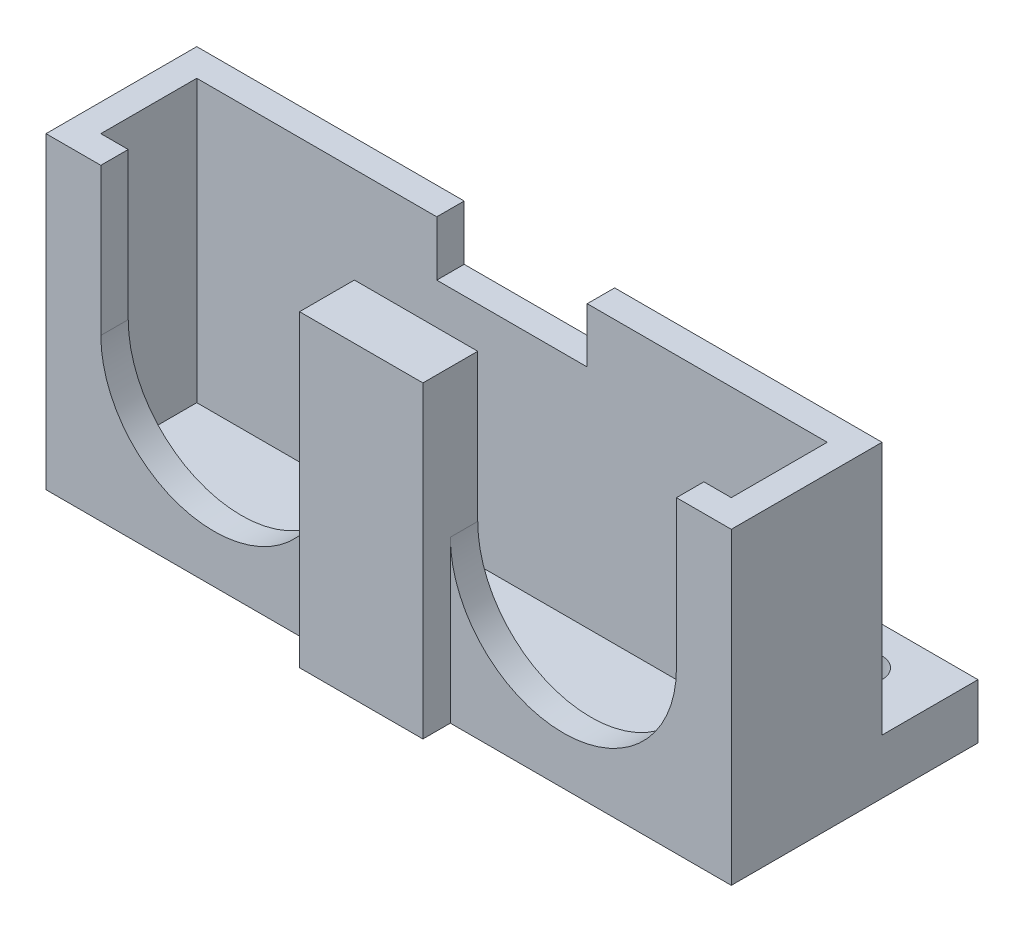
from build123d import *

# Parameters (mm, degrees)
ESBO_O1_W                = 50
ESBO_O1_H                = 11
RESSALTO_EXTRUS_O1_DEPTH = 22.5
ESBO_O2_W                = 46
ESBO_O2_H                = 7
CORTE_EXTRUS_O1_DEPTH    = 20.5
ESBO_O3_W                = 10.97916057
ESBO_O3_H                = 2
CORTE_EXTRUS_O2_DEPTH    = 4
CORTE_EXTRUS_O3_DEPTH    = 4
ESBO_O9_W                = 50
ESBO_O9_H                = 4
RESSALTO_EXTRUS_O4_DEPTH = 7
ESBO_O13_R               = 1.5
CORTE_EXTRUS_O4_DEPTH    = 7
ESBO_O19_W               = 9
ESBO_O19_H               = 4
RESSALTO_EXTRUS_O5_DEPTH = 22.5


with BuildPart() as part:
    # Esboço1 → Ressalto-extrusão1 (new body)
    with BuildSketch(Plane(origin=(0, 0, 0), x_dir=(1, 0, 0), z_dir=(0, 1, 0))):
        Rectangle(ESBO_O1_W, ESBO_O1_H)
    extrude(amount=RESSALTO_EXTRUS_O1_DEPTH)

    # Esboço2 → Corte-extrusão1 (cut)
    with BuildSketch(Plane(origin=(0, 22.5, 0), x_dir=(1, 0, 0), z_dir=(0, 1, 0))):
        Rectangle(ESBO_O2_W, ESBO_O2_H)
    extrude(amount=-CORTE_EXTRUS_O1_DEPTH, mode=Mode.SUBTRACT)

    # Esboço3 → Corte-extrusão2 (cut)
    with BuildSketch(Plane(origin=(0, 22.5, 0), x_dir=(1, 0, 0), z_dir=(0, 1, 0))):
        with Locations((0, 4.5)):
            Rectangle(ESBO_O3_W, ESBO_O3_H)
    extrude(amount=-CORTE_EXTRUS_O2_DEPTH, mode=Mode.SUBTRACT)

    # Esboço5 → Corte-extrusão3 (cut)
    with BuildSketch(Plane.XY.offset(5.5)):
        with BuildLine():
            Line((-21, 22.5), (-4.5, 22.5))
            Line((-4.5, 22.5), (-4.5, 11.75))
            ThreePointArc((-4.5, 11.75), (-12.75, 3.5), (-21, 11.75))
            Line((-21, 11.75), (-21, 22.5))
        make_face()
        with BuildLine():
            Line((4.5, 22.5), (21, 22.5))
            Line((21, 22.5), (21, 11.75))
            ThreePointArc((21, 11.75), (12.75, 3.5), (4.5, 11.75))
            Line((4.5, 11.75), (4.5, 22.5))
        make_face()
    extrude(amount=-CORTE_EXTRUS_O3_DEPTH, mode=Mode.SUBTRACT)

    # Esboço9 → Ressalto-extrusão4 (add)
    with BuildSketch(Plane(origin=(0, 0, -5.5), x_dir=(-1, 0, 0), z_dir=(0, 0, -1))):
        with Locations((0, 2)):
            Rectangle(ESBO_O9_W, ESBO_O9_H)
    extrude(amount=RESSALTO_EXTRUS_O4_DEPTH)

    # Esboço13 → Corte-extrusão4 (cut)
    with BuildSketch(Plane(origin=(0, 4, 0), x_dir=(1, 0, 0), z_dir=(0, 1, 0))):
        with Locations(Location((10, 9, 0), (0, 0, 270))):
            Circle(ESBO_O13_R)
        with Locations(Location((5, 9, 0), (0, 0, 270))):
            Circle(ESBO_O13_R)
        with Locations(Location((20, 9, 0), (0, 0, 270))):
            Circle(ESBO_O13_R)
        with Locations(Location((15, 9, 0), (0, 0, 270))):
            Circle(ESBO_O13_R)
        with Locations(Location((0, 9, 0), (0, 0, 270))):
            Circle(ESBO_O13_R)
        with Locations(Location((-5, 9, 0), (0, 0, 270))):
            Circle(ESBO_O13_R)
        with Locations(Location((-10, 9, 0), (0, 0, 270))):
            Circle(ESBO_O13_R)
        with Locations(Location((-15, 9, 0), (0, 0, 270))):
            Circle(ESBO_O13_R)
        with Locations(Location((-20, 9, 0), (0, 0, 270))):
            Circle(ESBO_O13_R)
    extrude(amount=-CORTE_EXTRUS_O4_DEPTH, mode=Mode.SUBTRACT)

    # Esboço19 → Ressalto-extrusão5 (add)
    with BuildSketch(Plane(origin=(0, 22.5, 0), x_dir=(1, 0, 0), z_dir=(0, 1, 0))):
        with Locations((0, -5.5)):
            Rectangle(ESBO_O19_W, ESBO_O19_H)
    extrude(amount=-RESSALTO_EXTRUS_O5_DEPTH)


solid = part.part
